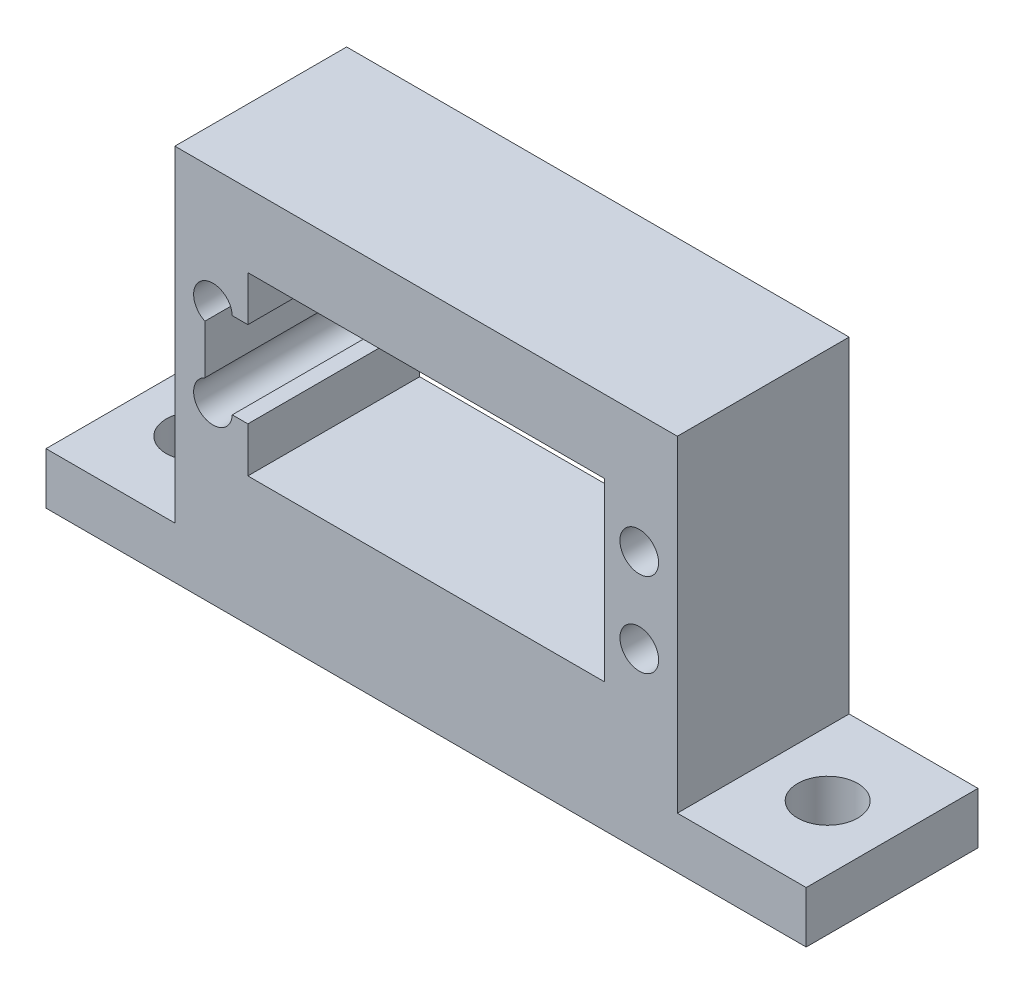
from build123d import *

# Parameters (mm, degrees)
SKETCH1_R           = 2.25
BOSS_EXTRUDE1_DEPTH = 20
SKETCH2_R           = 3.5
CUT_EXTRUDE1_DEPTH  = 62.660866844


with BuildPart() as part:
    # Sketch1 → Boss-Extrude1 (new body)
    with BuildSketch(Plane.XY):
        Polygon((-44.25, 0), (44.25, 0), (44.25, 6), (29.25, 6), (29.25, 44), (-29.25, 44), (-29.25, 6), (-44.25, 6), align=None)
        with Locations((24.815, 30.15)):
            Circle(SKETCH1_R, mode=Mode.SUBTRACT)
        with Locations(Location((24.815, 20.35, 0), (0, 0, 180))):
            Circle(SKETCH1_R, mode=Mode.SUBTRACT)
        with BuildLine():
            Line((-20.75, 35.5), (20.75, 35.5))
            Line((20.75, 35.5), (20.75, 15))
            Line((20.75, 15), (-20.75, 15))
            Line((-20.75, 15), (-20.75, 20.25))
            Line((-20.75, 20.25), (-22.567223321, 20.25))
            ThreePointArc((-22.567223321, 20.25), (-26.07307026, 18.484588726), (-25.75, 22.396527547))
            Line((-25.75, 22.396527547), (-25.75, 28.103472453))
            ThreePointArc((-25.75, 28.103472453), (-26.07307026, 32.015411274), (-22.567223321, 30.25))
            Line((-22.567223321, 30.25), (-20.75, 30.25))
            Line((-20.75, 30.25), (-20.75, 35.5))
        make_face(mode=Mode.SUBTRACT)
    extrude(amount=BOSS_EXTRUDE1_DEPTH)

    # Sketch2 → Cut-Extrude1 (cut, through all)
    with BuildSketch(Plane(origin=(0, 6, 0), x_dir=(1, 0, 0), z_dir=(0, 1, 0))):
        with Locations(Location((36.75, -10, 0), (0, 0, 180))):
            Circle(SKETCH2_R)
        with Locations((-36.75, -10)):
            Circle(SKETCH2_R)
    extrude(amount=-CUT_EXTRUDE1_DEPTH, mode=Mode.SUBTRACT)


solid = part.part
